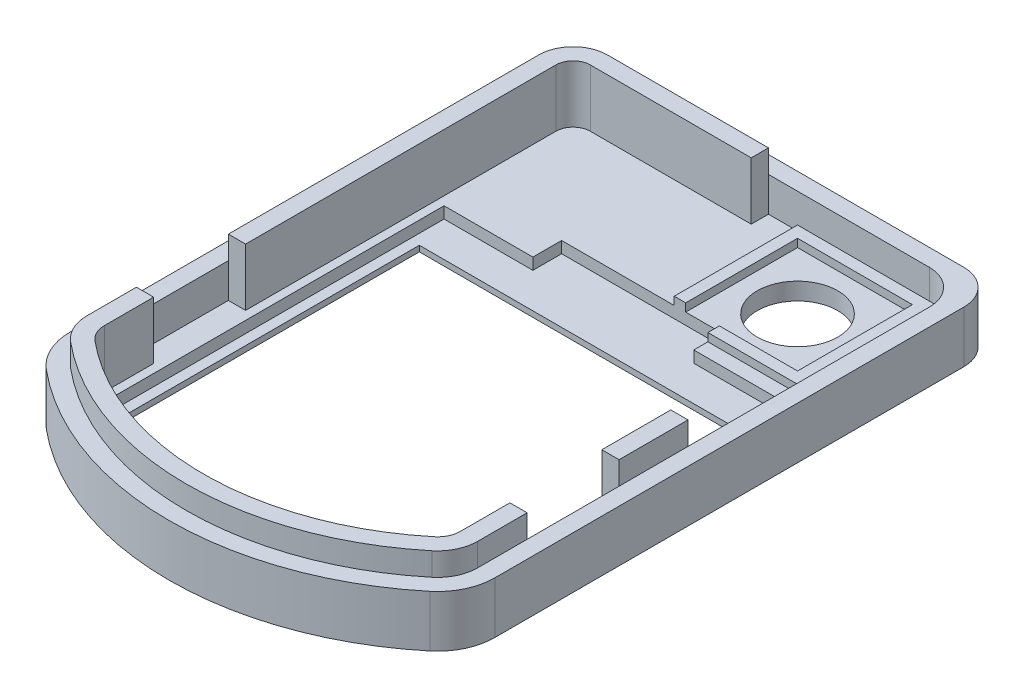
from build123d import *

# Parameters (mm, degrees)
SKETCH1_R               = 3.5
BOSS_EXTRUDE1_DEPTH     = 1.5
BOSS_EXTRUDE2_DEPTH     = 3
SKETCH3_W               = 12
SKETCH3_H               = 12
SKETCH3_W_2             = 10
SKETCH3_H_2             = 10
BOSS_EXTRUDE3_DEPTH     = 0.7
SKETCH5_W               = 27.66
SKETCH5_H               = 27.66
CUT_EXTRUDE1_DEPTH      = 66.25114788
CUT_EXTRUDE2_DEPTH      = 66.25114788
CUT_EXTRUDE2_DEPTH_BACK = 1
SKETCH6_W               = 29.5
SKETCH6_H               = 31.81
CUT_EXTRUDE3_DEPTH      = 66.25114788
CUT_EXTRUDE3_DEPTH_BACK = 1
SKETCH4_W               = 14
SKETCH4_H               = 2.5
BOSS_EXTRUDE5_START     = -3
SKETCH8_W               = 1.5
SKETCH8_H               = 6
BOSS_EXTRUDE5_DEPTH     = 5


with BuildPart() as part:
    # Sketch1 → Boss-Extrude1 (new body)
    with BuildSketch(Plane(origin=(0, 0, 0), x_dir=(1, 0, 0), z_dir=(0, 1, 0))):
        with BuildLine():
            Line((0, -43.797867681), (0, -43))
            Line((0, -43), (0, -3))
            ThreePointArc((0, -3), (0.878679656, -0.878679656), (3, 0))
            Line((3, 0), (34, 0))
            ThreePointArc((34, 0), (36.121320344, -0.878679656), (37, -3))
            Line((37, -3), (37, -43))
            Line((37, -43), (37, -43.797867681))
            ThreePointArc((37, -43.797867681), (36.524802839, -45.925344888), (35.189536294, -47.648433643))
            ThreePointArc((35.189536294, -47.648433643), (18.5, -53.662950904), (1.810463706, -47.648433643))
            ThreePointArc((1.810463706, -47.648433643), (0.475197161, -45.925344888), (0, -43.797867681))
        make_face()
        with Locations(Location((27.28, -7.75, 0), (0, 0, 270))):
            Circle(SKETCH1_R, mode=Mode.SUBTRACT)
    extrude(amount=BOSS_EXTRUDE1_DEPTH)

    # Sketch2 → Boss-Extrude2 (add)
    with BuildSketch(Plane(origin=(0, 1.5, 0), x_dir=(1, 0, 0), z_dir=(0, 1, 0))):
        with BuildLine():
            Line((0, -43.797867681), (0, -43))
            Line((0, -43), (0, -3))
            ThreePointArc((0, -3), (0.878679656, -0.878679656), (3, 0))
            Line((3, 0), (34, 0))
            ThreePointArc((34, 0), (36.121320344, -0.878679656), (37, -3))
            Line((37, -3), (37, -43))
            Line((37, -43), (37, -43.797867681))
            ThreePointArc((37, -43.797867681), (36.524802839, -45.925344888), (35.189536294, -47.648433643))
            ThreePointArc((35.189536294, -47.648433643), (18.5, -53.662950904), (1.810463706, -47.648433643))
            ThreePointArc((1.810463706, -47.648433643), (0.475197161, -45.925344888), (0, -43.797867681))
        make_face()
        with BuildLine():
            Line((1.5, -43.797867681), (1.5, -43))
            Line((1.5, -43), (1.5, -4.5))
            ThreePointArc((1.5, -4.5), (2.378679656, -2.378679656), (4.5, -1.5))
            Line((4.5, -1.5), (32.5, -1.5))
            ThreePointArc((32.5, -1.5), (34.621320344, -2.378679656), (35.5, -4.5))
            Line((35.5, -4.5), (35.5, -43))
            Line((35.5, -43), (35.5, -43.797867681))
            ThreePointArc((35.5, -43.797867681), (35.167361988, -45.287101726), (34.232675406, -46.493263855))
            ThreePointArc((34.232675406, -46.493263855), (18.5, -52.162950904), (2.767324594, -46.493263855))
            ThreePointArc((2.767324594, -46.493263855), (1.832638012, -45.287101726), (1.5, -43.797867681))
        make_face(mode=Mode.SUBTRACT)
    extrude(amount=BOSS_EXTRUDE2_DEPTH)

    # Sketch3 → Boss-Extrude3 (add)
    with BuildSketch(Plane(origin=(0, 1.5, 0), x_dir=(1, 0, 0), z_dir=(0, 1, 0))):
        with Locations((27.28, -7.75)):
            Rectangle(SKETCH3_W, SKETCH3_H)
        with Locations((27.28, -7.75)):
            Rectangle(SKETCH3_W_2, SKETCH3_H_2, mode=Mode.SUBTRACT)
    extrude(amount=BOSS_EXTRUDE3_DEPTH)

    # Sketch5 → Cut-Extrude1 (cut, through all)
    with BuildSketch(Plane(origin=(0, 1.5, 0), x_dir=(1, 0, 0), z_dir=(0, 1, 0))):
        with Locations((18.48, -31.86)):
            Rectangle(SKETCH5_W, SKETCH5_H)
    extrude(amount=-CUT_EXTRUDE1_DEPTH, mode=Mode.SUBTRACT)

    # Sketch6 → Cut-Extrude2 (cut, two sides: drawn at the far end of the back side and taken through both)
    with BuildSketch(Plane(origin=(0, 1.5, 0), x_dir=(1, 0, 0), z_dir=(0, 1, 0)).offset(-CUT_EXTRUDE2_DEPTH_BACK)):
        with Locations((18.5, -30.885)):
            Rectangle(SKETCH6_W, SKETCH6_H)
    extrude(amount=CUT_EXTRUDE2_DEPTH + CUT_EXTRUDE2_DEPTH_BACK, mode=Mode.SUBTRACT)

    # Sketch4 → Cut-Extrude3 (cut, two sides: drawn at the far end of the back side and taken through both)
    with BuildSketch(Plane(origin=(0, 1.5, 0), x_dir=(1, 0, 0), z_dir=(0, 1, 0)).offset(-CUT_EXTRUDE3_DEPTH_BACK)):
        with Locations((18.48, -13.73)):
            Rectangle(SKETCH4_W, SKETCH4_H)
    extrude(amount=CUT_EXTRUDE3_DEPTH + CUT_EXTRUDE3_DEPTH_BACK, mode=Mode.SUBTRACT)

    # Sketch8 → Boss-Extrude5 (add)
    with BuildSketch(Plane(origin=(0, 4.5, 0), x_dir=(1, 0, 0), z_dir=(0, 1, 0)).offset(BOSS_EXTRUDE5_START)):
        with BuildLine():
            Line((1.5, -4.5), (1.5, -31.5))
            Line((1.5, -31.5), (3, -31.5))
            Line((3, -31.5), (3, -4.5))
            ThreePointArc((3, -4.5), (3.439339828, -3.439339828), (4.5, -3))
            Line((4.5, -3), (18.5, -3))
            Line((18.5, -3), (18.5, -1.5))
            Line((18.5, -1.5), (4.5, -1.5))
            ThreePointArc((4.5, -1.5), (2.378679656, -2.378679656), (1.5, -4.5))
        make_face()
        with Locations((34.75, -28.5)):
            Rectangle(SKETCH8_W, SKETCH8_H)
        with BuildLine():
            Line((35.5, -43), (35.5, -43.797867681))
            ThreePointArc((35.5, -43.797867681), (35.167361988, -45.287101726), (34.232675406, -46.493263855))
            ThreePointArc((34.232675406, -46.493263855), (18.5, -52.162950904), (2.767324594, -46.493263855))
            ThreePointArc((2.767324594, -46.493263855), (1.832638012, -45.287101726), (1.5, -43.797867681))
            Line((1.5, -43.797867681), (1.5, -43))
            Line((1.5, -43), (1.5, -39.5))
            Line((1.5, -39.5), (3, -39.5))
            Line((3, -39.5), (3, -43))
            Line((3, -43), (3, -43.797867681))
            ThreePointArc((3, -43.797867681), (3.190078864, -44.648858564), (3.724185482, -45.338094066))
            ThreePointArc((3.724185482, -45.338094066), (18.5, -50.662950904), (33.275814518, -45.338094066))
            ThreePointArc((33.275814518, -45.338094066), (33.809921136, -44.648858564), (34, -43.797867681))
            Line((34, -43.797867681), (34, -43))
            Line((34, -43), (34, -39.5))
            Line((34, -39.5), (35.5, -39.5))
            Line((35.5, -39.5), (35.5, -43))
        make_face()
    extrude(amount=BOSS_EXTRUDE5_DEPTH)


solid = part.part
